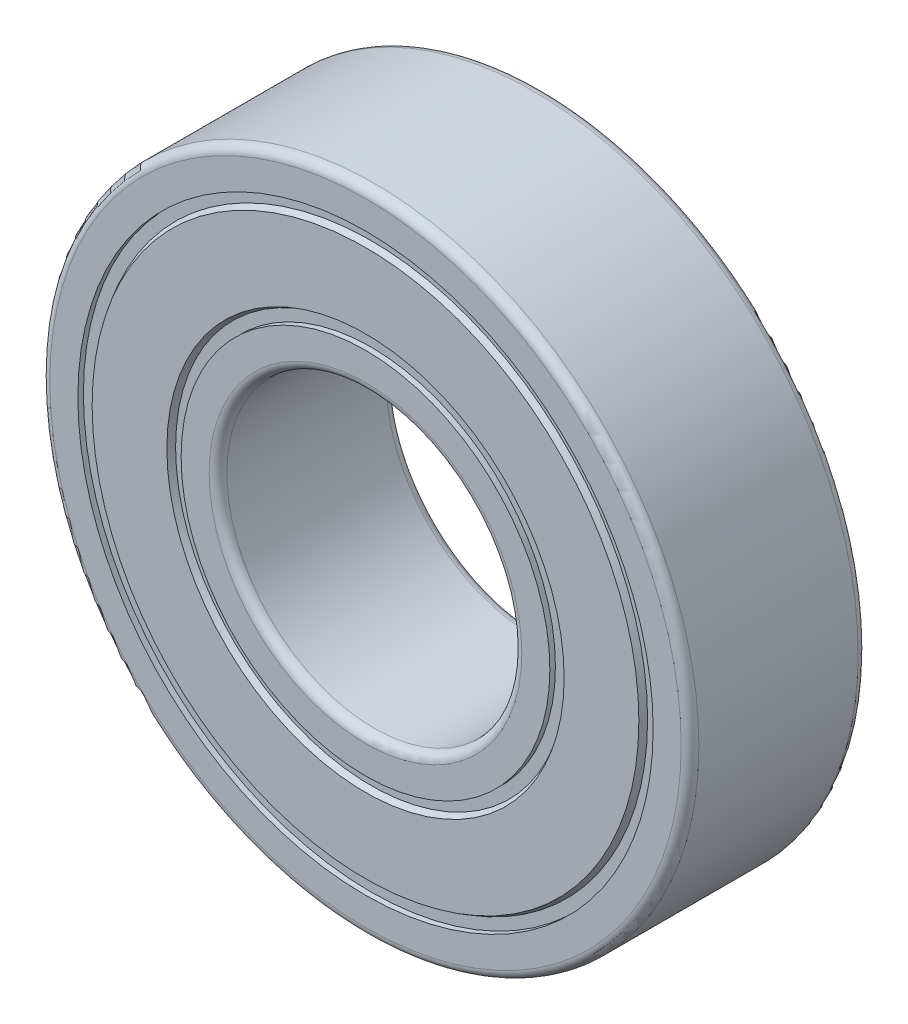
from build123d import *

# Parameters (mm, degrees)
SKETCH2_R = 1.875


with BuildPart() as part:
    # Sketch2 → Base-Revolve (revolve)
    with BuildSketch(Plane(origin=(0, 0, 0), x_dir=(1, 0, 0), z_dir=(0, 1, 0)), mode=Mode.PRIVATE) as base_revolve_sk:
        with BuildLine():
            Line((-9.75, 0), (-9.75, -0.1875))
            Line((-9.75, -0.1875), (-9.375, -0.1875))
            Line((-9.375, -0.1875), (-9.266746825, 0))
            Line((-9.266746825, 0), (-6.733253175, 0))
            Line((-6.733253175, 0), (-6.625, -0.1875))
            Line((-6.625, -0.1875), (-6.25, -0.1875))
            Line((-6.25, -0.1875), (-6.25, 0))
            Line((-6.25, 0), (-5.3, 0))
            ThreePointArc((-5.3, 0), (-5.087867966, -0.087867966), (-5, -0.3))
            Line((-5, -0.3), (-5, -5.7))
            ThreePointArc((-5, -5.7), (-5.087867966, -5.912132034), (-5.3, -6))
            Line((-5.3, -6), (-6.25, -6))
            Line((-6.25, -6), (-6.25, -5.8125))
            Line((-6.25, -5.8125), (-6.625, -5.8125))
            Line((-6.625, -5.8125), (-6.733253175, -6))
            Line((-6.733253175, -6), (-9.266746825, -6))
            Line((-9.266746825, -6), (-9.375, -5.8125))
            Line((-9.375, -5.8125), (-9.75, -5.8125))
            Line((-9.75, -5.8125), (-9.75, -6))
            Line((-9.75, -6), (-10.7, -6))
            ThreePointArc((-10.7, -6), (-10.912132034, -5.912132034), (-11, -5.7))
            Line((-11, -5.7), (-11, -0.3))
            ThreePointArc((-11, -0.3), (-10.912132034, -0.087867966), (-10.7, 0))
            Line((-10.7, 0), (-9.75, 0))
        make_face()
        with Locations((-8, -3)):
            Circle(SKETCH2_R, mode=Mode.SUBTRACT)
    revolve(base_revolve_sk.sketch.rotate(Axis((0, 0, 19), (0, 0, -1)), 180), axis=Axis((0, 0, 19), (0, 0, -1)))


solid = part.part
